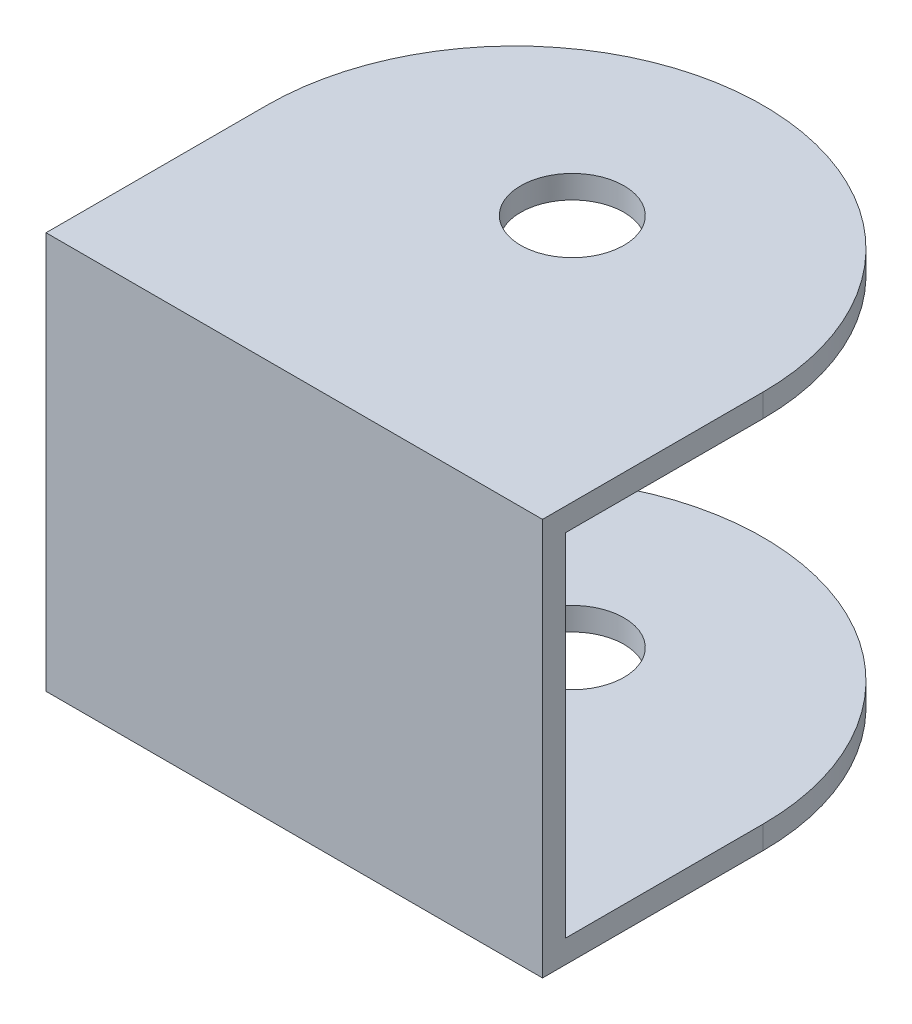
from build123d import *

# Parameters (mm, degrees)
BOSS_EXTRUDE2_DEPTH = 25.4
SKETCH2_W           = 64.689945596
SKETCH2_H           = 22.4536
CUT_EXTRUDE1_DEPTH  = 51.521177338
SKETCH5_R           = 3.302
CUT_EXTRUDE2_DEPTH  = 43.38328072


with BuildPart() as part:
    # Sketch1 → Boss-Extrude2 (new body)
    with BuildSketch(Plane(origin=(0, 0, 0), x_dir=(1, 0, 0), z_dir=(0, 1, 0))):
        with BuildLine():
            Line((15.875, 14.111111111), (15.875, 0))
            Line((15.875, 0), (0, 0))
            Line((0, 0), (-15.875, 0))
            Line((-15.875, 0), (-15.875, 14.111111111))
            ThreePointArc((-15.875, 14.111111111), (0, 29.986111111), (15.875, 14.111111111))
        make_face()
    extrude(amount=BOSS_EXTRUDE2_DEPTH)

    # Sketch2 → Cut-Extrude1 (cut, through all)
    with BuildSketch(Plane(origin=(15.875, 0, 0), x_dir=(0, 0, -1), z_dir=(1, 0, 0))):
        with Locations((33.818172798, 12.7)):
            Rectangle(SKETCH2_W, SKETCH2_H)
    extrude(amount=-CUT_EXTRUDE1_DEPTH, mode=Mode.SUBTRACT)

    # Sketch5 → Cut-Extrude2 (cut, through all)
    with BuildSketch(Plane.XZ):
        with Locations(Location((0, -17.78, 0), (0, 0, 270))):
            Circle(SKETCH5_R)
    extrude(amount=-CUT_EXTRUDE2_DEPTH, mode=Mode.SUBTRACT)


solid = part.part
